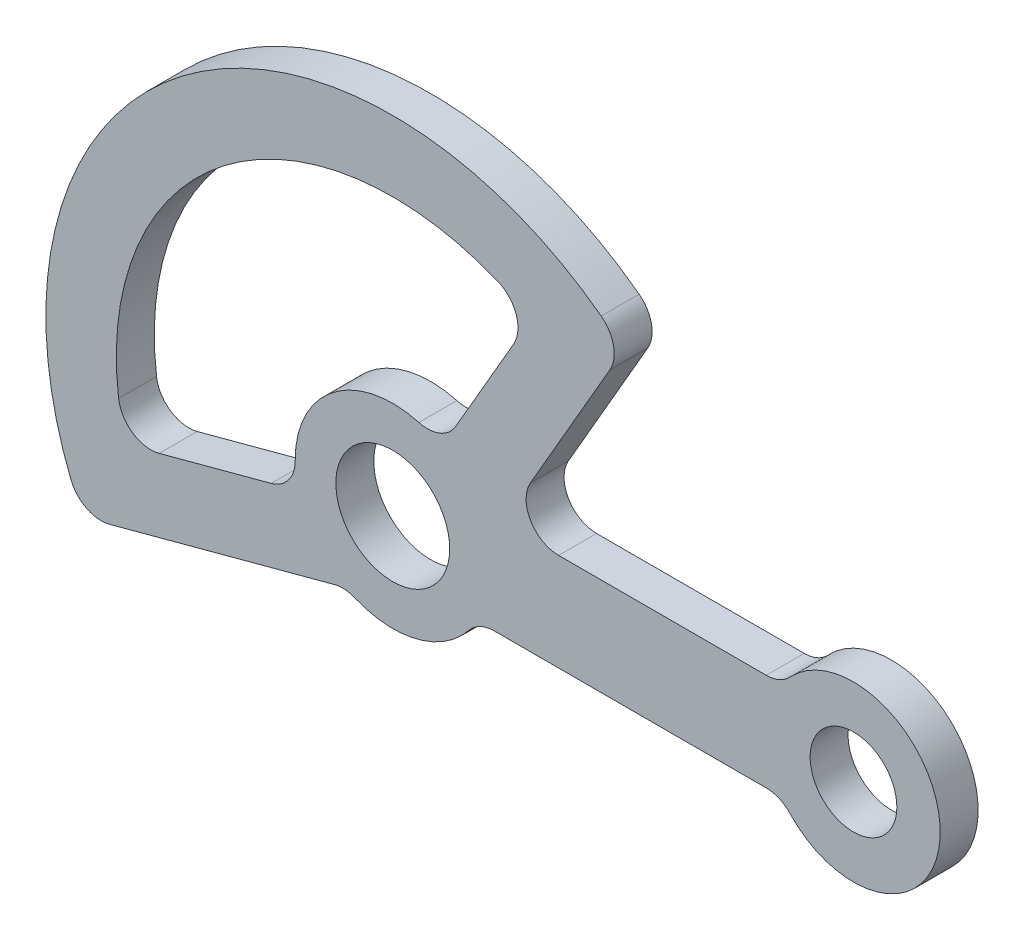
from build123d import *

# Parameters (mm, degrees)
SKETCH1_R           = 10.5
SKETCH1_R_2         = 8
BOSS_EXTRUDE1_DEPTH = 7


with BuildPart() as part:
    # Sketch1 → Boss-Extrude1 (new body)
    with BuildSketch(Plane.XY):
        with BuildLine():
            Line((40.04634859, 43.362310416), (25.403411844, 18))
            ThreePointArc((25.403411844, 18), (25.403411844, 12), (30.599564267, 9))
            Line((30.599564267, 9), (68.906523061, 9))
            ThreePointArc((68.906523061, 9), (71.299695166, 9.497934272), (73.295653135, 10.909090909))
            ThreePointArc((73.295653135, 10.909090909), (101, 0), (73.295653135, -10.909090909))
            ThreePointArc((73.295653135, -10.909090909), (71.299695166, -9.497934272), (68.906523061, -9))
            Line((68.906523061, -9), (18.734993995, -9))
            ThreePointArc((18.734993995, -9), (16.136917784, -9.591673087), (14.051245496, -11.25))
            ThreePointArc((14.051245496, -11.25), (4.455015534, -17.439978113), (-6.934268235, -16.610717144))
            ThreePointArc((-6.934268235, -16.610717144), (-8.844993295, -16.161017697), (-10.79860525, -16.352067901))
            Line((-10.79860525, -16.352067901), (-52.24953322, -27.458810577))
            ThreePointArc((-52.24953322, -27.458810577), (-56.48282468, -27.031269974), (-59.368217921, -23.904282062))
            ThreePointArc((-59.368217921, -23.904282062), (-38.960731457, 50.774613779), (38.455388874, 51.158411493))
            ThreePointArc((38.455388874, 51.158411493), (40.729032534, 47.562011618), (40.04634859, 43.362310416))
        make_face()
        Circle(SKETCH1_R, mode=Mode.SUBTRACT)
        with Locations((85, 0)):
            Circle(SKETCH1_R_2, mode=Mode.SUBTRACT)
        with BuildLine():
            Line((11.618950039, 20.124611797), (22.299103121, 38.623179569))
            ThreePointArc((22.299103121, 38.623179569), (22.781794932, 43.559859246), (19.383344125, 47.172936845))
            ThreePointArc((19.383344125, 47.172936845), (-31.046832879, 40.461020355), (-50.582336617, -6.513618221))
            ThreePointArc((-50.582336617, -6.513618221), (-47.971955445, -10.731402919), (-43.078559215, -11.542865153))
            Line((-43.078559215, -11.542865153), (-22.446087833, -6.014411108))
            ThreePointArc((-22.446087833, -6.014411108), (-19.222277472, -3.849682749), (-17.999251578, -0.164142113))
            ThreePointArc((-17.999251578, -0.164142113), (-10.957705722, 14.280360125), (4.817098212, 17.343458848))
            ThreePointArc((4.817098212, 17.343458848), (8.69359949, 17.570923037), (11.618950039, 20.124611797))
        make_face(mode=Mode.SUBTRACT)
    extrude(amount=BOSS_EXTRUDE1_DEPTH)


solid = part.part
